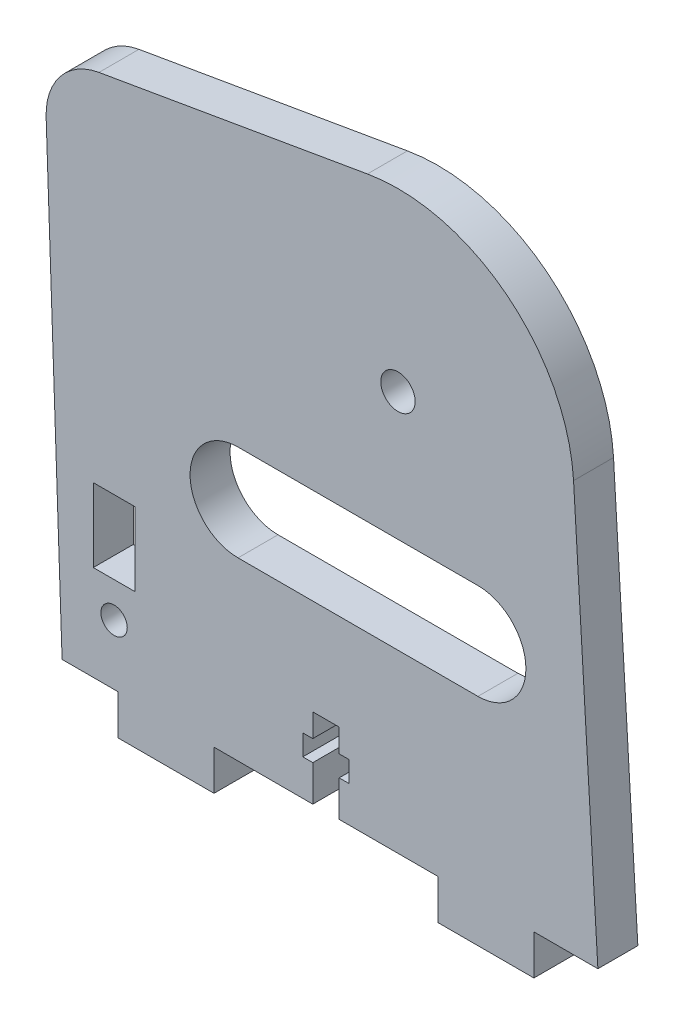
from build123d import *

# Parameters (mm, degrees)
ESKIZ_KONTUR_W        = 5.2
ESKIZ_KONTUR_H        = 9.2
PLASTINA_DEPTH        = 5
OTVERSTIYA_DEPTH      = 85.528105852
OTVERSTIYA_DEPTH_BACK = 85.528105852
ESKIZ_OTVERSTIYA_R    = 1.65
ESKIZ_OTVERSTIYA_R_2  = 2.15


with BuildPart() as part:
    # Eskiz_kontur → Plastina (new body)
    with BuildSketch(Plane.XY):
        with BuildLine():
            Line((21.958964111, 51.343070401), (24.999994111, 4.01e-07))
            Line((24.999994111, 4.01e-07), (17, 4.01e-07))
            Line((17, 4.01e-07), (17, -5))
            Line((17, -5), (5, -5))
            Line((5, -5), (5, 0))
            Line((5, 0), (-7.35, 0))
            Line((-7.35, 0), (-7.35, 4.5))
            Line((-7.35, 4.5), (-6.1, 4.5))
            Line((-6.1, 4.5), (-6.1, 7.1))
            Line((-6.1, 7.1), (-7.35, 7.1))
            Line((-7.35, 7.1), (-7.35, 10))
            Line((-7.35, 10), (-10.65, 10))
            Line((-10.65, 10), (-10.65, 7.1))
            Line((-10.65, 7.1), (-11.9, 7.1))
            Line((-11.9, 7.1), (-11.9, 4.5))
            Line((-11.9, 4.5), (-10.65, 4.5))
            Line((-10.65, 4.5), (-10.65, 0))
            Line((-10.65, 0), (-23, 0))
            Line((-23, 0), (-23, -5))
            Line((-23, -5), (-35, -5))
            Line((-35, -5), (-35, 0))
            Line((-35, 0), (-42, 0))
            Line((-42, 0), (-43.99513, 57.7208))
            ThreePointArc((-43.99513, 57.7208), (-42.217170806, 63.034563621), (-37.389183787, 65.878463067))
            Line((-37.389183787, 65.878463067), (-3.820263787, 71.665773067))
            ThreePointArc((-3.820263787, 71.665773067), (13.620063981, 67.276975245), (21.958964111, 51.343070401))
        make_face()
        with Locations((-35.5, 16.5)):
            Rectangle(ESKIZ_KONTUR_W, ESKIZ_KONTUR_H, mode=Mode.SUBTRACT)
        with BuildLine():
            Line((10, 34), (-20, 34))
            ThreePointArc((-20, 34), (-26, 28), (-20, 22))
            Line((-20, 22), (10, 22))
            ThreePointArc((10, 22), (16, 28), (10, 34))
        make_face(mode=Mode.SUBTRACT)
    extrude(amount=PLASTINA_DEPTH)

    # Eskiz_otverstiya → Otverstiya (cut, two sides: drawn at the far end of the back side and taken through both)
    with BuildSketch(Plane.XY.offset(-OTVERSTIYA_DEPTH_BACK)):
        with Locations((-35.5, 7.5)):
            Circle(ESKIZ_OTVERSTIYA_R)
        with Locations((0, 50)):
            Circle(ESKIZ_OTVERSTIYA_R_2)
    extrude(amount=OTVERSTIYA_DEPTH + OTVERSTIYA_DEPTH_BACK, mode=Mode.SUBTRACT)


solid = part.part
